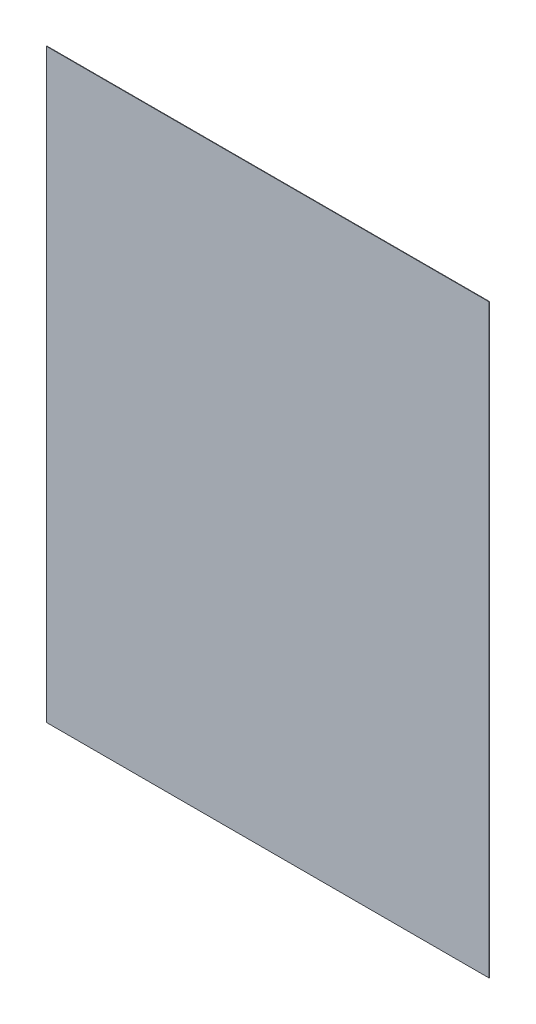
from build123d import *

# Parameters (mm, degrees)
STORE_DIS_ARKA_1_START = -818.5
SKETCH1_W              = 1397
SKETCH1_H              = 1848.5
STORE_DIS_ARKA_1_DEPTH = 1.5


with BuildPart() as part:
    # Sketch1 → STORE_dis_arka_1 (new body)
    with BuildSketch(Plane.XY.offset(STORE_DIS_ARKA_1_START)):
        with Locations((700, 1044.25)):
            Rectangle(SKETCH1_W, SKETCH1_H)
    extrude(amount=-STORE_DIS_ARKA_1_DEPTH)


solid = part.part
